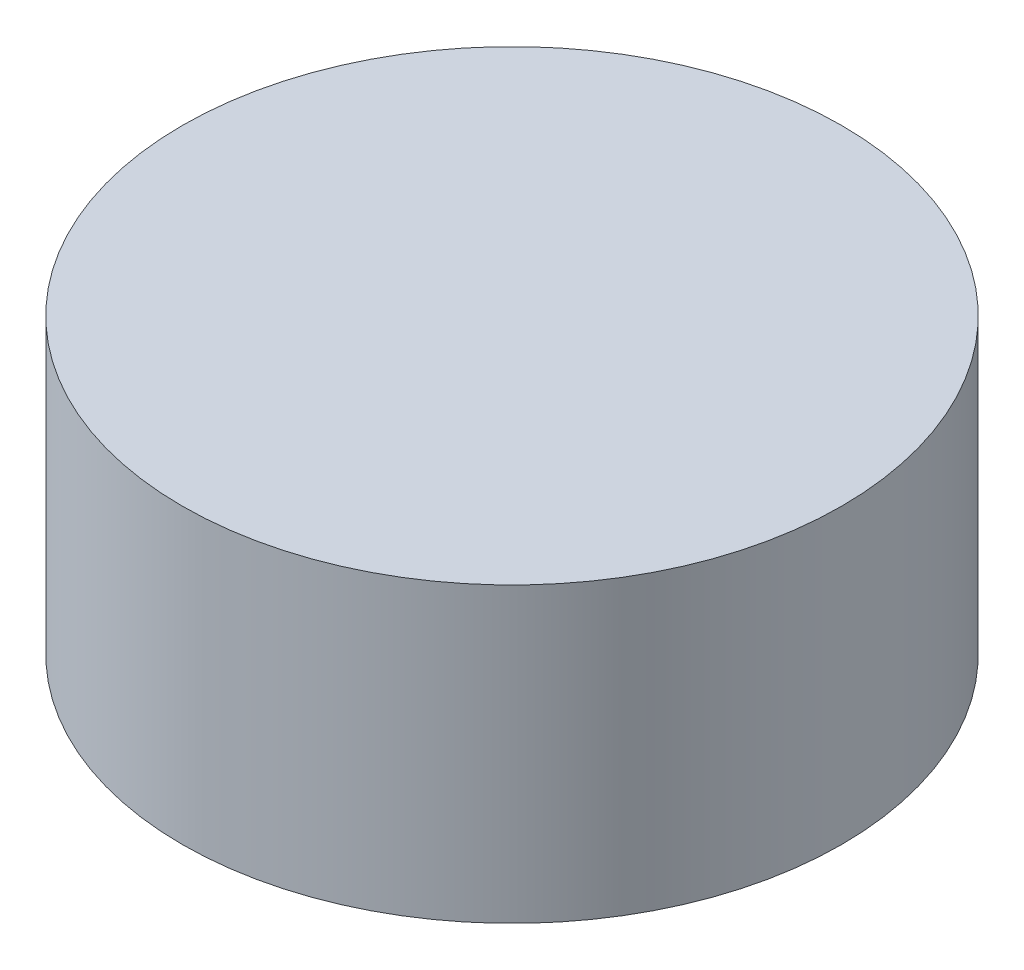
from build123d import *

# Parameters (mm, degrees)
CROQUIS1_R              = 13.5
SALIENTE_EXTRUIR1_DEPTH = 12


with BuildPart() as part:
    # Croquis1 → Saliente-Extruir1 (new body)
    with BuildSketch(Plane(origin=(0, 0, 0), x_dir=(1, 0, 0), z_dir=(0, 1, 0))):
        with Locations(Location((0, 0, 0), (0, 0, 270))):
            Circle(CROQUIS1_R)
    extrude(amount=SALIENTE_EXTRUIR1_DEPTH)


solid = part.part
